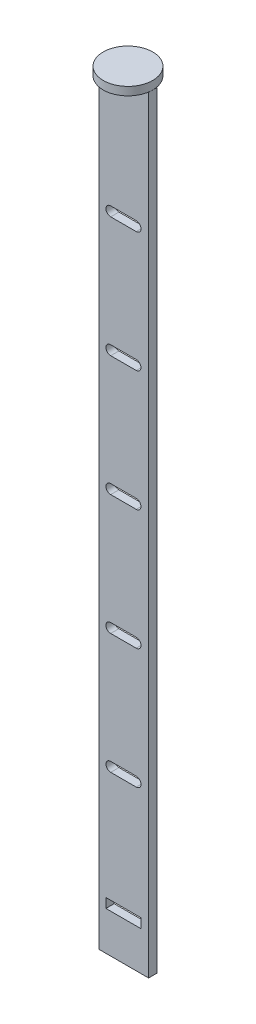
from build123d import *

# Parameters (mm, degrees)
SLOT_0_START            = 20.304722665
SKETCH1_W               = 6
SKETCH1_H               = 4.6
SLOT_0_DEPTH            = 16.995277335
BAR_START               = 17
SKETCH2_W               = 4
SKETCH2_H               = 372
BAR_DEPTH               = 24
SLOT_END_1_START        = 495
SKETCH3_R               = 2.3
SLOT_END_1_DEPTH        = 6
SLOT_END_B_1_START      = 495
SKETCH4_R               = 2.3
SLOT_END_B_1_DEPTH      = 6
CUT_EXTRUDE1_DEPTH      = 642.623721507
CUT_EXTRUDE1_DEPTH_BACK = 642.623721507
SKETCH5_W               = 12.395277335
SKETCH5_H               = 4.6
SLOT_END_2_START        = 495
SKETCH6_R               = 2.3
SLOT_END_2_DEPTH        = 6
SLOT_END_B_2_START      = 495
SKETCH7_R               = 2.3
SLOT_END_B_2_DEPTH      = 6
CUT_EXTRUDE2_DEPTH      = 642.623721507
CUT_EXTRUDE2_DEPTH_BACK = 642.623721507
SKETCH8_W               = 12.395277335
SKETCH8_H               = 4.6
SLOT_END_3_START        = 495
SKETCH9_R               = 2.3
SLOT_END_3_DEPTH        = 6
SLOT_END_B_3_START      = 495
SKETCH10_R              = 2.3
SLOT_END_B_3_DEPTH      = 6
CUT_EXTRUDE3_DEPTH      = 642.623721507
CUT_EXTRUDE3_DEPTH_BACK = 642.623721507
SKETCH11_W              = 12.395277335
SKETCH11_H              = 4.6
SLOT_END_4_START        = 495
SKETCH12_R              = 2.3
SLOT_END_4_DEPTH        = 6
SLOT_END_B_4_START      = 495
SKETCH13_R              = 2.3
SLOT_END_B_4_DEPTH      = 6
CUT_EXTRUDE4_DEPTH      = 642.623721507
CUT_EXTRUDE4_DEPTH_BACK = 642.623721507
SKETCH14_W              = 12.395277335
SKETCH14_H              = 4.6
SLOT_END_5_START        = 495
SKETCH15_R              = 2.3
SLOT_END_5_DEPTH        = 6
SLOT_END_B_5_START      = 495
SKETCH16_R              = 2.3
SLOT_END_B_5_DEPTH      = 6
CUT_EXTRUDE5_DEPTH      = 642.623721507
CUT_EXTRUDE5_DEPTH_BACK = 642.623721507
SKETCH17_W              = 12.395277335
SKETCH17_H              = 4.6
CROSSHEAD_START         = 400
SKETCH18_R              = 12
CROSSHEAD_DEPTH         = 4


with BuildPart() as part:
    # Sketch1 → slot_0 (new body)
    with BuildSketch(Plane(origin=(0, 0, 0), x_dir=(0, 0, -1), z_dir=(1, 0, 0)).offset(SLOT_0_START)):
        with Locations((-498, 49.166666667)):
            Rectangle(SKETCH1_W, SKETCH1_H)
    extrude(amount=SLOT_0_DEPTH)


with BuildPart() as body_2:
    # Sketch2 → bar (new body)
    with BuildSketch(Plane(origin=(0, 0, 0), x_dir=(0, 0, -1), z_dir=(1, 0, 0)).offset(BAR_START)):
        with Locations((-498, 214)):
            Rectangle(SKETCH2_W, SKETCH2_H)
    extrude(amount=BAR_DEPTH)

    # Combine1: cut part
    add(part.part, mode=Mode.SUBTRACT)


with BuildPart() as body_2_2:
    # Sketch3 → slot_end_1 (new body)
    with BuildSketch(Plane.XY.offset(SLOT_END_1_START)):
        with Locations((22.604722665, 107.5)):
            Circle(SKETCH3_R)
    extrude(amount=SLOT_END_1_DEPTH)


with BuildPart() as body_2_1:
    add(body_2.part)

    # Combine2: cut body 2 2
    add(body_2_2.part, mode=Mode.SUBTRACT)


with BuildPart() as body_2_3:
    # Sketch4 → slot_end_b_1 (new body)
    with BuildSketch(Plane.XY.offset(SLOT_END_B_1_START)):
        with Locations((35, 107.5)):
            Circle(SKETCH4_R)
    extrude(amount=SLOT_END_B_1_DEPTH)


with BuildPart() as body_2_4:
    add(body_2_1.part)

    # Combine3: cut body 2 3
    add(body_2_3.part, mode=Mode.SUBTRACT)

    # Sketch5 → Cut-Extrude1 (cut, two sides: drawn at the far end of the back side and taken through both)
    with BuildSketch(Plane.XY.offset(-CUT_EXTRUDE1_DEPTH_BACK)):
        with Locations((28.802361332, 107.5)):
            Rectangle(SKETCH5_W, SKETCH5_H)
    extrude(amount=CUT_EXTRUDE1_DEPTH + CUT_EXTRUDE1_DEPTH_BACK, mode=Mode.SUBTRACT)


with BuildPart() as body_2_4_1:
    # Sketch6 → slot_end_2 (new body)
    with BuildSketch(Plane.XY.offset(SLOT_END_2_START)):
        with Locations((22.604722665, 165.833333333)):
            Circle(SKETCH6_R)
    extrude(amount=SLOT_END_2_DEPTH)


with BuildPart() as body_2_5:
    add(body_2_4.part)

    # Combine4: cut body 2 4
    add(body_2_4_1.part, mode=Mode.SUBTRACT)


with BuildPart() as body_2_5_1:
    # Sketch7 → slot_end_b_2 (new body)
    with BuildSketch(Plane.XY.offset(SLOT_END_B_2_START)):
        with Locations((35, 165.833333333)):
            Circle(SKETCH7_R)
    extrude(amount=SLOT_END_B_2_DEPTH)


with BuildPart() as body_2_6:
    add(body_2_5.part)

    # Combine5: cut body 2 5
    add(body_2_5_1.part, mode=Mode.SUBTRACT)

    # Sketch8 → Cut-Extrude2 (cut, two sides: drawn at the far end of the back side and taken through both)
    with BuildSketch(Plane.XY.offset(-CUT_EXTRUDE2_DEPTH_BACK)):
        with Locations((28.802361332, 165.833333333)):
            Rectangle(SKETCH8_W, SKETCH8_H)
    extrude(amount=CUT_EXTRUDE2_DEPTH + CUT_EXTRUDE2_DEPTH_BACK, mode=Mode.SUBTRACT)


with BuildPart() as body_2_6_1:
    # Sketch9 → slot_end_3 (new body)
    with BuildSketch(Plane.XY.offset(SLOT_END_3_START)):
        with Locations((22.604722665, 224.166666667)):
            Circle(SKETCH9_R)
    extrude(amount=SLOT_END_3_DEPTH)


with BuildPart() as body_2_7:
    add(body_2_6.part)

    # Combine6: cut body 2 6
    add(body_2_6_1.part, mode=Mode.SUBTRACT)


with BuildPart() as body_2_7_1:
    # Sketch10 → slot_end_b_3 (new body)
    with BuildSketch(Plane.XY.offset(SLOT_END_B_3_START)):
        with Locations((35, 224.166666667)):
            Circle(SKETCH10_R)
    extrude(amount=SLOT_END_B_3_DEPTH)


with BuildPart() as body_2_8:
    add(body_2_7.part)

    # Combine7: cut body 2 7
    add(body_2_7_1.part, mode=Mode.SUBTRACT)

    # Sketch11 → Cut-Extrude3 (cut, two sides: drawn at the far end of the back side and taken through both)
    with BuildSketch(Plane.XY.offset(-CUT_EXTRUDE3_DEPTH_BACK)):
        with Locations((28.802361332, 224.166666667)):
            Rectangle(SKETCH11_W, SKETCH11_H)
    extrude(amount=CUT_EXTRUDE3_DEPTH + CUT_EXTRUDE3_DEPTH_BACK, mode=Mode.SUBTRACT)


with BuildPart() as body_2_8_1:
    # Sketch12 → slot_end_4 (new body)
    with BuildSketch(Plane.XY.offset(SLOT_END_4_START)):
        with Locations((22.604722665, 282.5)):
            Circle(SKETCH12_R)
    extrude(amount=SLOT_END_4_DEPTH)


with BuildPart() as body_2_9:
    add(body_2_8.part)

    # Combine8: cut body 2 8
    add(body_2_8_1.part, mode=Mode.SUBTRACT)


with BuildPart() as body_2_9_1:
    # Sketch13 → slot_end_b_4 (new body)
    with BuildSketch(Plane.XY.offset(SLOT_END_B_4_START)):
        with Locations((35, 282.5)):
            Circle(SKETCH13_R)
    extrude(amount=SLOT_END_B_4_DEPTH)


with BuildPart() as body_2_10:
    add(body_2_9.part)

    # Combine9: cut body 2 9
    add(body_2_9_1.part, mode=Mode.SUBTRACT)

    # Sketch14 → Cut-Extrude4 (cut, two sides: drawn at the far end of the back side and taken through both)
    with BuildSketch(Plane.XY.offset(-CUT_EXTRUDE4_DEPTH_BACK)):
        with Locations((28.802361332, 282.5)):
            Rectangle(SKETCH14_W, SKETCH14_H)
    extrude(amount=CUT_EXTRUDE4_DEPTH + CUT_EXTRUDE4_DEPTH_BACK, mode=Mode.SUBTRACT)


with BuildPart() as body_2_10_1:
    # Sketch15 → slot_end_5 (new body)
    with BuildSketch(Plane.XY.offset(SLOT_END_5_START)):
        with Locations((22.604722665, 340.833333333)):
            Circle(SKETCH15_R)
    extrude(amount=SLOT_END_5_DEPTH)


with BuildPart() as body_2_11:
    add(body_2_10.part)

    # Combine10: cut body 2 10
    add(body_2_10_1.part, mode=Mode.SUBTRACT)


with BuildPart() as body_2_11_1:
    # Sketch16 → slot_end_b_5 (new body)
    with BuildSketch(Plane.XY.offset(SLOT_END_B_5_START)):
        with Locations((35, 340.833333333)):
            Circle(SKETCH16_R)
    extrude(amount=SLOT_END_B_5_DEPTH)


with BuildPart() as body_2_12:
    add(body_2_11.part)

    # Combine11: cut body 2 11
    add(body_2_11_1.part, mode=Mode.SUBTRACT)

    # Sketch17 → Cut-Extrude5 (cut, two sides: drawn at the far end of the back side and taken through both)
    with BuildSketch(Plane.XY.offset(-CUT_EXTRUDE5_DEPTH_BACK)):
        with Locations((28.802361332, 340.833333333)):
            Rectangle(SKETCH17_W, SKETCH17_H)
    extrude(amount=CUT_EXTRUDE5_DEPTH + CUT_EXTRUDE5_DEPTH_BACK, mode=Mode.SUBTRACT)


with BuildPart() as body_2_12_1:
    # Sketch18 → crosshead (new body)
    with BuildSketch(Plane(origin=(0, 0, 0), x_dir=(1, 0, 0), z_dir=(0, 1, 0)).offset(CROSSHEAD_START)):
        with Locations((29, -498)):
            Circle(SKETCH18_R)
    extrude(amount=CROSSHEAD_DEPTH)


solid = Compound([body_2_12.part, body_2_12_1.part])
